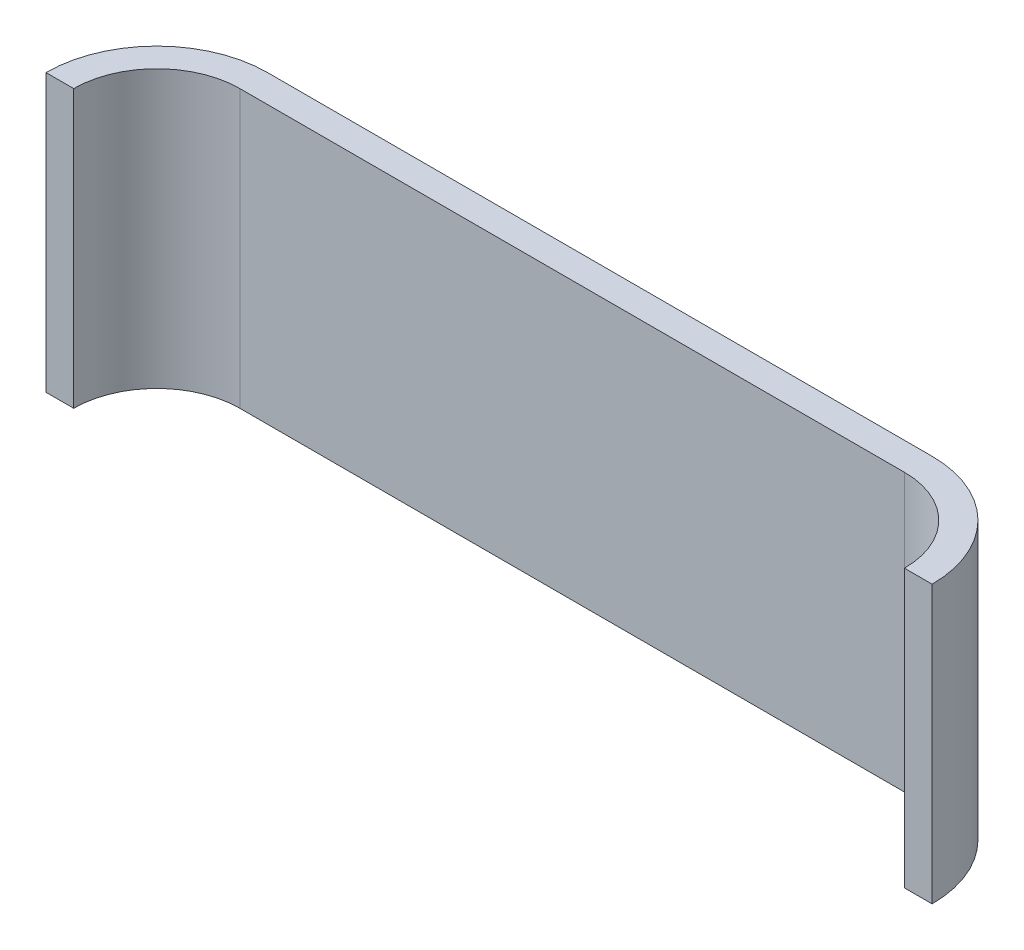
from build123d import *

# Parameters (mm, degrees)
BOSS_EXTRUDE1_DEPTH = 5000


with BuildPart() as part:
    # Sketch1 → Boss-Extrude1 (new body)
    with BuildSketch(Plane(origin=(0, 0, 0), x_dir=(1, 0, 0), z_dir=(0, 1, 0))):
        with BuildLine():
            Line((1500, 0), (13500, 0))
            ThreePointArc((13500, 0), (14560.66017178, -439.33982822), (15000, -1500))
            Line((15000, -1500), (15500, -1500))
            ThreePointArc((15500, -1500), (14914.213562373, -85.786437627), (13500, 500))
            Line((13500, 500), (1500, 500))
            ThreePointArc((1500, 500), (85.786437627, -85.786437627), (-500, -1500))
            Line((-500, -1500), (0, -1500))
            ThreePointArc((0, -1500), (439.33982822, -439.33982822), (1500, 0))
        make_face()
    extrude(amount=BOSS_EXTRUDE1_DEPTH)


solid = part.part
